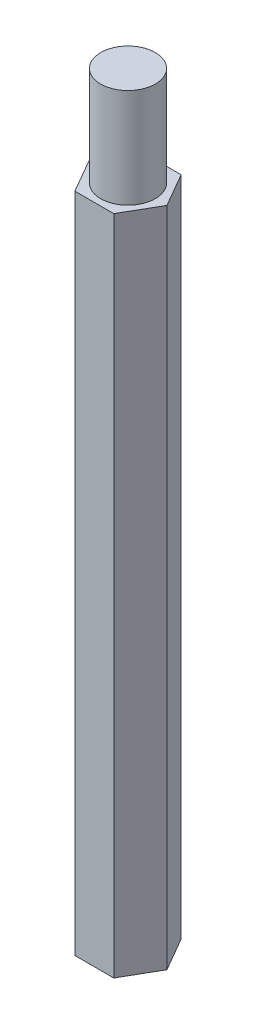
from build123d import *

# Parameters (mm, degrees)
EXTRUDE_1_DEPTH     = 40
SKETCH_2_R          = 1.65
EXTRUDE_2_DEPTH     = 6
SKETCH_3_R          = 1.65
CUT_EXTRUDE_1_DEPTH = 6


with BuildPart() as part:
    # 草图1 → 凸台-拉伸1 (new body)
    with BuildSketch(Plane(origin=(0, 0, 0), x_dir=(1, 0, 0), z_dir=(0, 1, 0))):
        Polygon((1.175, 2.035159699), (-1.175, 2.035159699), (-2.35, 0), (-1.175, -2.035159699), (1.175, -2.035159699), (2.35, 0), align=None)
    extrude(amount=EXTRUDE_1_DEPTH)

    # 草图2 → 凸台-拉伸2 (add)
    with BuildSketch(Plane(origin=(0, 40, 0), x_dir=(1, 0, 0), z_dir=(0, 1, 0))):
        with Locations(Location((0, 0, 0), (0, 0, 270))):
            Circle(SKETCH_2_R)
    extrude(amount=EXTRUDE_2_DEPTH)

    # 草图3 → 切除-拉伸1 (cut)
    with BuildSketch(Plane.XZ):
        with Locations(Location((0, 0, 0), (0, 0, 90))):
            Circle(SKETCH_3_R)
    extrude(amount=-CUT_EXTRUDE_1_DEPTH, mode=Mode.SUBTRACT)


solid = part.part
